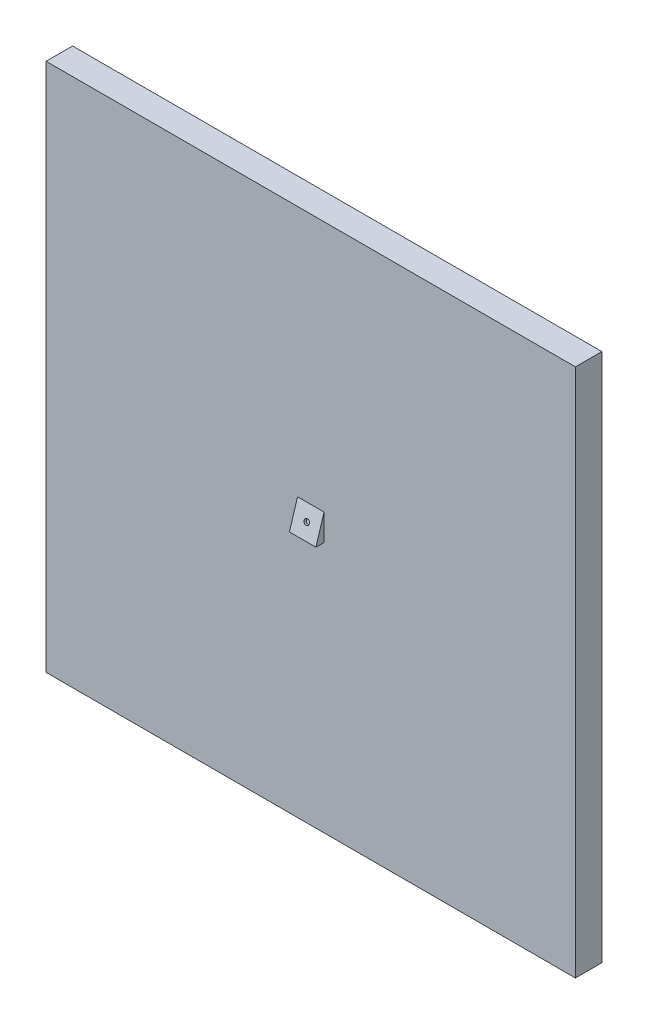
from build123d import *

# Parameters (mm, degrees)
SKIZZE1_W                       = 20
SKIZZE1_H                       = 20
AUFSATZ_LINEAR_AUSTRAGEN1_DEPTH = 1
SKIZZE2_W                       = 1
SKIZZE2_H                       = 1
AUFSATZ_LINEAR_AUSTRAGEN2_DEPTH = 0.306
SCHNITT_LINEAR_AUSTRAGEN1_DEPTH = 10.306
SKIZZE4_R                       = 0.1
SCHNITT_LINEAR_AUSTRAGEN2_DEPTH = 0.1


with BuildPart() as part:
    # Skizze1 → Aufsatz-Linear austragen1 (new body)
    with BuildSketch(Plane.XY):
        with Locations((-2.517837541, -1.875)):
            Rectangle(SKIZZE1_W, SKIZZE1_H)
    extrude(amount=AUFSATZ_LINEAR_AUSTRAGEN1_DEPTH)

    # Skizze2 → Aufsatz-Linear austragen2 (add)
    with BuildSketch(Plane.XY.offset(1)):
        with Locations((-2.517837541, -1.875)):
            Rectangle(SKIZZE2_W, SKIZZE2_H)
    extrude(amount=AUFSATZ_LINEAR_AUSTRAGEN2_DEPTH)

    # Skizze3 → Schnitt-Linear austragen1 (cut)
    with BuildSketch(Plane.ZY.offset(3.017837541)):
        Polygon((1, -1.375), (1.306, -2.375), (1.306, -1.375), align=None)
    extrude(amount=-SCHNITT_LINEAR_AUSTRAGEN1_DEPTH, mode=Mode.SUBTRACT)

    # Skizze4 → Schnitt-Linear austragen2 (cut)
    with BuildSketch(Plane(origin=(0, 0.162074493, 0.529655205), x_dir=(1, 0, 0), z_dir=(1.0151852031872135e-15, 0.2926072129783145, 0.9562327221513931))):
        with Locations(Location((-2.517837541, -2.130312471, 0), (0, 0, 270))):
            Circle(SKIZZE4_R)
    extrude(amount=-SCHNITT_LINEAR_AUSTRAGEN2_DEPTH, mode=Mode.SUBTRACT)


solid = part.part
